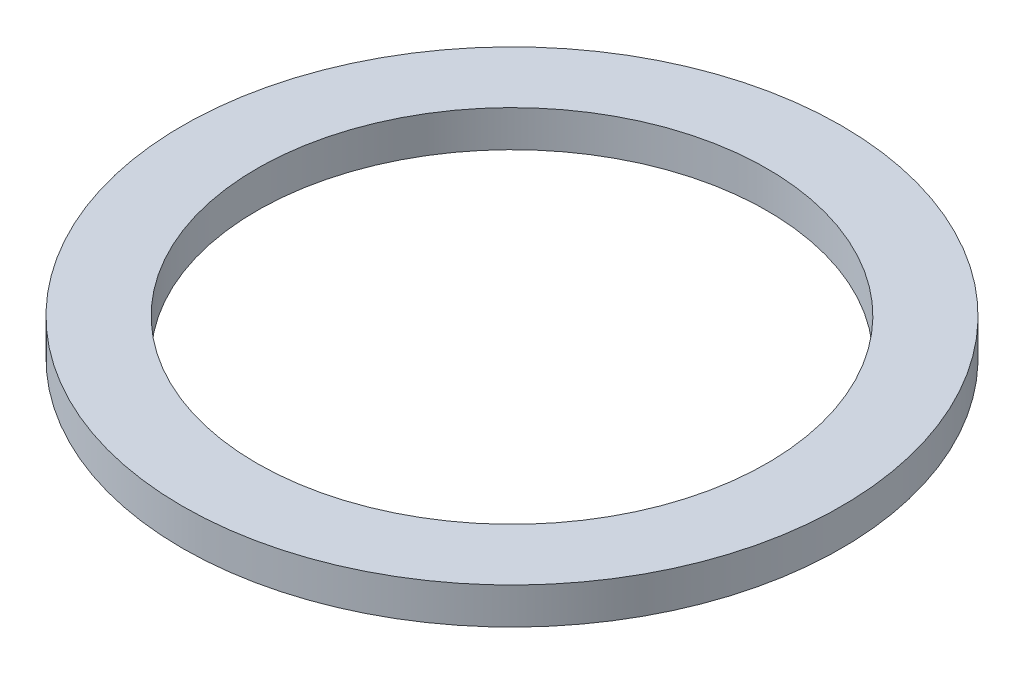
from build123d import *

# Parameters (mm, degrees)
SKETCH1_R           = 14.351
BOSS_EXTRUDE1_DEPTH = 1.5875
SKETCH2_R           = 11.1125
CUT_EXTRUDE1_DEPTH  = 21.357371104


with BuildPart() as part:
    # Sketch1 → Boss-Extrude1 (new body)
    with BuildSketch(Plane(origin=(0, 0, 0), x_dir=(1, 0, 0), z_dir=(0, 1, 0))):
        with Locations(Location((0, 0, 0), (0, 0, 270))):
            Circle(SKETCH1_R)
    extrude(amount=BOSS_EXTRUDE1_DEPTH)

    # Sketch2 → Cut-Extrude1 (cut, through all)
    with BuildSketch(Plane(origin=(0, 1.5875, 0), x_dir=(1, 0, 0), z_dir=(0, 1, 0))):
        with Locations(Location((0, 0, 0), (0, 0, 270))):
            Circle(SKETCH2_R)
    extrude(amount=-CUT_EXTRUDE1_DEPTH, mode=Mode.SUBTRACT)


solid = part.part
